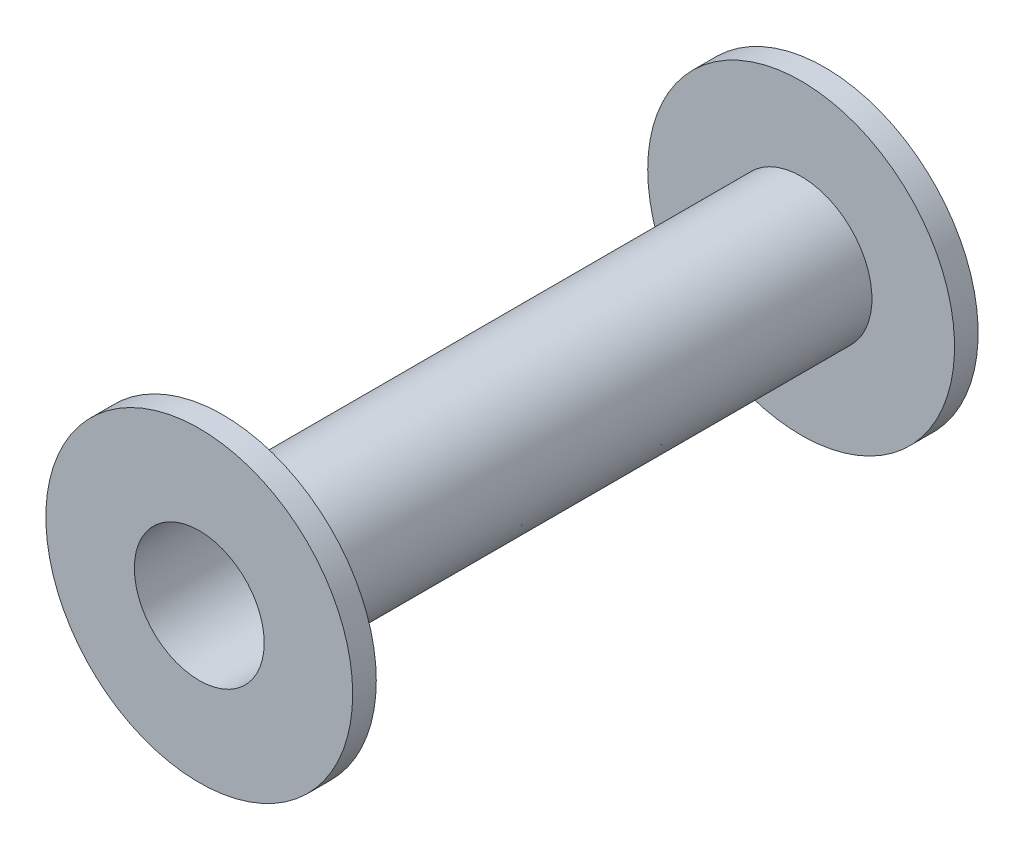
from build123d import *

# Parameters (mm, degrees)
SKETCH1_R      = 6
SKETCH1_R_2    = 5.5
EXTRUDE1_DEPTH = 49
SKETCH2_R      = 13
SKETCH2_R_2    = 5.5
EXTRUDE3_DEPTH = 2
EXTRUDE4_START = 2
SKETCH3_R      = 13
SKETCH3_R_2    = 5.5
EXTRUDE4_DEPTH = 2


with BuildPart() as part:
    # Sketch1 → Extrude1 (new body)
    with BuildSketch(Plane.XY):
        Circle(SKETCH1_R)
        Circle(SKETCH1_R_2, mode=Mode.SUBTRACT)
    extrude(amount=EXTRUDE1_DEPTH)

    # Sketch2 → Extrude3 (add)
    with BuildSketch(Plane.XY.offset(49)):
        Circle(SKETCH2_R)
        Circle(SKETCH2_R_2, mode=Mode.SUBTRACT)
    extrude(amount=EXTRUDE3_DEPTH)

    # Sketch3 → Extrude4 (add)
    with BuildSketch(Plane(origin=(0, 0, 0), x_dir=(-1, 0, 0), z_dir=(0, 0, -1)).offset(EXTRUDE4_START)):
        with Locations(Location((0, 0, 0), (0, 0, 180))):
            Circle(SKETCH3_R)
        Circle(SKETCH3_R_2, mode=Mode.SUBTRACT)
    extrude(amount=-EXTRUDE4_DEPTH)


solid = part.part
